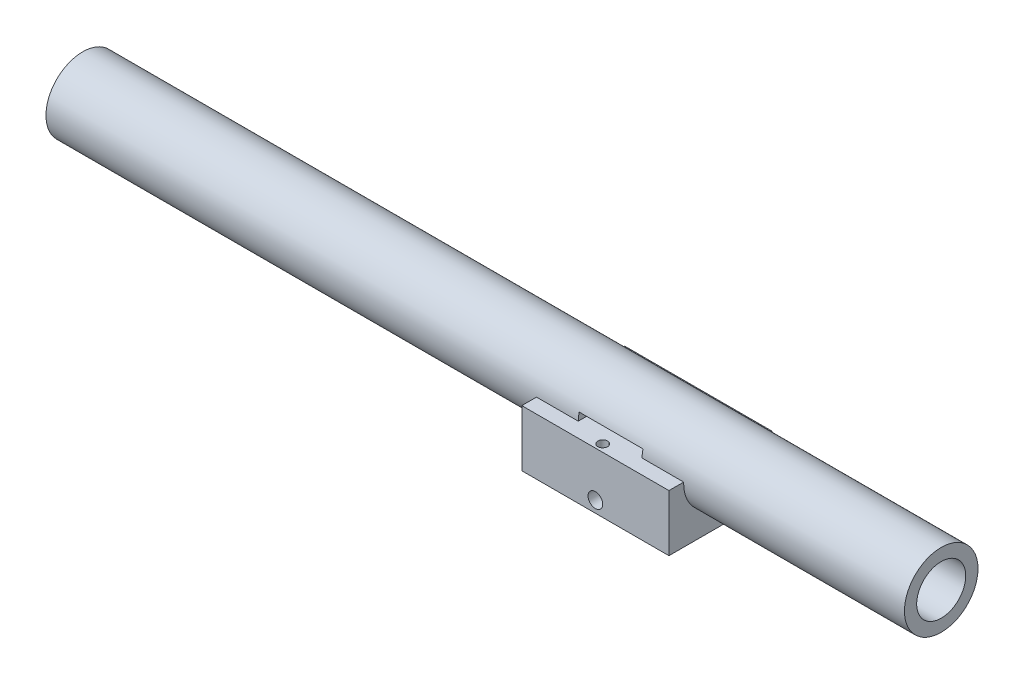
from build123d import *

# Parameters (mm, degrees)
SKETCH1_R                = 1.905
SKETCH1_R_2              = 1.27
BOSS_EXTRUDE1_DEPTH      = 44.45
BOSS_EXTRUDE3_DEPTH      = 0.762
BOSS_EXTRUDE3_DEPTH_BACK = 4.572
SKETCH4_R                = 1.27
CUT_EXTRUDE2_DEPTH       = 46.99
SKETCH5_W                = 3.302
SKETCH5_H                = 0.381
CUT_EXTRUDE3_DEPTH       = 1.016
SKETCH6_R                = 0.381
CUT_EXTRUDE4_DEPTH       = 5.588
SKETCH8_R                = 0.254
CUT_EXTRUDE5_DEPTH       = 1.27


with BuildPart() as part:
    # Sketch1 → Boss-Extrude1 (new body)
    with BuildSketch(Plane(origin=(0, 0, 0), x_dir=(0, 0, -1), z_dir=(1, 0, 0))):
        with Locations((-37.290755903, 15.049483632)):
            Circle(SKETCH1_R)
        with Locations((-37.290755903, 15.049483632)):
            Circle(SKETCH1_R_2, mode=Mode.SUBTRACT)
    extrude(amount=BOSS_EXTRUDE1_DEPTH)

    # Sketch2 → Boss-Extrude3 (add, two sides: drawn at the far end of the back side and taken through both)
    with BuildSketch(Plane.XY.offset(39.195755903).offset(-BOSS_EXTRUDE3_DEPTH_BACK)):
        Polygon((32.385, 15.120134353), (33.02, 15.120134353), (33.02, 12.199134353), (25.4, 12.199134353), (25.4, 15.120134353), (26.035, 15.120134353), (31.75, 15.120134353), align=None)
    extrude(amount=BOSS_EXTRUDE3_DEPTH + BOSS_EXTRUDE3_DEPTH_BACK)

    # Sketch4 → Cut-Extrude2 (cut)
    with BuildSketch(Plane.ZY):
        with Locations(Location((37.290755903, 15.049483632, 0), (0, 0, 180))):
            Circle(SKETCH4_R)
    extrude(amount=-CUT_EXTRUDE2_DEPTH, mode=Mode.SUBTRACT)

    # Sketch5 → Cut-Extrude3 (cut)
    with BuildSketch(Plane.XY.offset(39.195755903)):
        with Locations((29.21, 15.310634353)):
            Rectangle(SKETCH5_W, SKETCH5_H)
    extrude(amount=-CUT_EXTRUDE3_DEPTH, mode=Mode.SUBTRACT)

    # Sketch6 → Cut-Extrude4 (cut)
    with BuildSketch(Plane.XY.offset(39.957755903)):
        with Locations((29.21, 12.789684353)):
            Circle(SKETCH6_R)
    extrude(amount=-CUT_EXTRUDE4_DEPTH, mode=Mode.SUBTRACT)

    # Sketch8 → Cut-Extrude5 (cut)
    with BuildSketch(Plane(origin=(0, 15.120134353, 0), x_dir=(1, 0, 0), z_dir=(0, 1, 0))):
        with Locations(Location((29.21, -39.576755903, 0), (0, 0, 270))):
            Circle(SKETCH8_R)
    extrude(amount=-CUT_EXTRUDE5_DEPTH, mode=Mode.SUBTRACT)


solid = part.part
